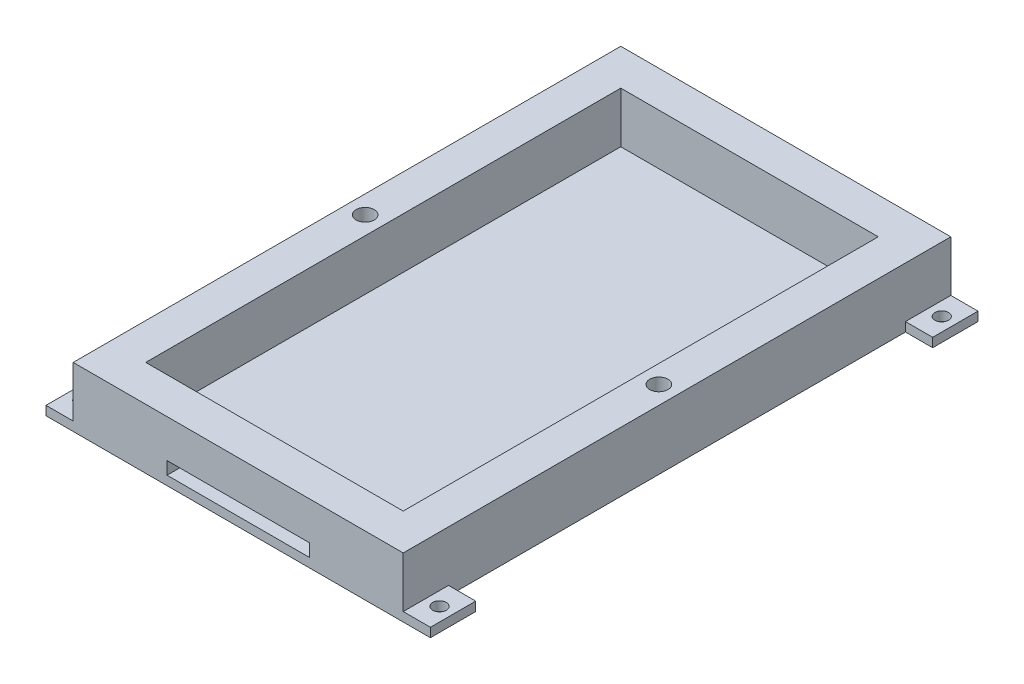
from build123d import *

# Parameters (mm, degrees)
ESBO_O1_W                = 36.4
ESBO_O1_H                = 60.4
ESBO_O1_W_2              = 28.4
ESBO_O1_H_2              = 52.4
RESSALTO_EXTRUS_O1_DEPTH = 6.6
ESBO_O2_W                = 28.4
ESBO_O2_H                = 52.4
RESSALTO_EXTRUS_O2_DEPTH = 1
ESBO_O5_W                = 3
ESBO_O5_H                = 5
ESBO_O5_R                = 0.75
RESSALTO_EXTRUS_O3_DEPTH = 1
ESBO_O6_R                = 1
CORTE_EXTRUS_O3_DEPTH    = 4
ESBO_O3_W                = 15.7
ESBO_O3_H                = 1.4
CORTE_EXTRUS_O4_DEPTH    = 5


with BuildPart() as part:
    # Esboço1 → Ressalto-extrusão1 (new body)
    with BuildSketch(Plane(origin=(0, 0, 0), x_dir=(1, 0, 0), z_dir=(0, 1, 0))):
        Rectangle(ESBO_O1_W, ESBO_O1_H)
        Rectangle(ESBO_O1_W_2, ESBO_O1_H_2, mode=Mode.SUBTRACT)
    extrude(amount=RESSALTO_EXTRUS_O1_DEPTH)

    # Esboço2 → Ressalto-extrusão2 (add)
    with BuildSketch(Plane(origin=(0, 0, 0), x_dir=(1, 0, 0), z_dir=(0, 1, 0))):
        Rectangle(ESBO_O2_W, ESBO_O2_H)
    extrude(amount=RESSALTO_EXTRUS_O2_DEPTH)

    # Esboço5 → Ressalto-extrusão3 (add)
    # profile 1 of 4: a face of its own
    with BuildSketch(Plane(origin=(0, 0, 0), x_dir=(1, 0, 0), z_dir=(0, 1, 0))):
        with Locations((-19.7, 27.7)):
            Rectangle(ESBO_O5_W, ESBO_O5_H)
        with Locations(Location((-19.7, 27.7, 0), (0, 0, 270))):
            Circle(ESBO_O5_R, mode=Mode.SUBTRACT)
    # profile 2 of 4: a face of its own
    with BuildSketch(Plane(origin=(0, 0, 0), x_dir=(1, 0, 0), z_dir=(0, 1, 0))):
        with Locations((-19.7, -27.7)):
            Rectangle(ESBO_O5_W, ESBO_O5_H)
        with Locations(Location((-19.7, -27.7, 0), (0, 0, 270))):
            Circle(ESBO_O5_R, mode=Mode.SUBTRACT)
    # profile 3 of 4: a face of its own
    with BuildSketch(Plane(origin=(0, 0, 0), x_dir=(1, 0, 0), z_dir=(0, 1, 0))):
        with Locations((19.7, -27.7)):
            Rectangle(ESBO_O5_W, ESBO_O5_H)
        with Locations(Location((19.7, -27.7, 0), (0, 0, 270))):
            Circle(ESBO_O5_R, mode=Mode.SUBTRACT)
    # profile 4 of 4: a face of its own
    with BuildSketch(Plane(origin=(0, 0, 0), x_dir=(1, 0, 0), z_dir=(0, 1, 0))):
        with Locations((19.7, 27.7)):
            Rectangle(ESBO_O5_W, ESBO_O5_H)
        with Locations(Location((19.7, 27.7, 0), (0, 0, 270))):
            Circle(ESBO_O5_R, mode=Mode.SUBTRACT)
    extrude(amount=RESSALTO_EXTRUS_O3_DEPTH)

    # Esboço6 → Corte-extrusão3 (cut)
    with BuildSketch(Plane(origin=(0, 6.6, 0), x_dir=(1, 0, 0), z_dir=(0, 1, 0))):
        with Locations(Location((-16.2, 0, 0), (0, 0, 270))):
            Circle(ESBO_O6_R)
        with Locations(Location((16.2, 0, 0), (0, 0, 270))):
            Circle(ESBO_O6_R)
    extrude(amount=-CORTE_EXTRUS_O3_DEPTH, mode=Mode.SUBTRACT)

    # Esboço3 → Corte-extrusão4 (cut)
    with BuildSketch(Plane.XY.offset(30.2)):
        with Locations((0, 1.7)):
            Rectangle(ESBO_O3_W, ESBO_O3_H)
    extrude(amount=-CORTE_EXTRUS_O4_DEPTH, mode=Mode.SUBTRACT)


solid = part.part
